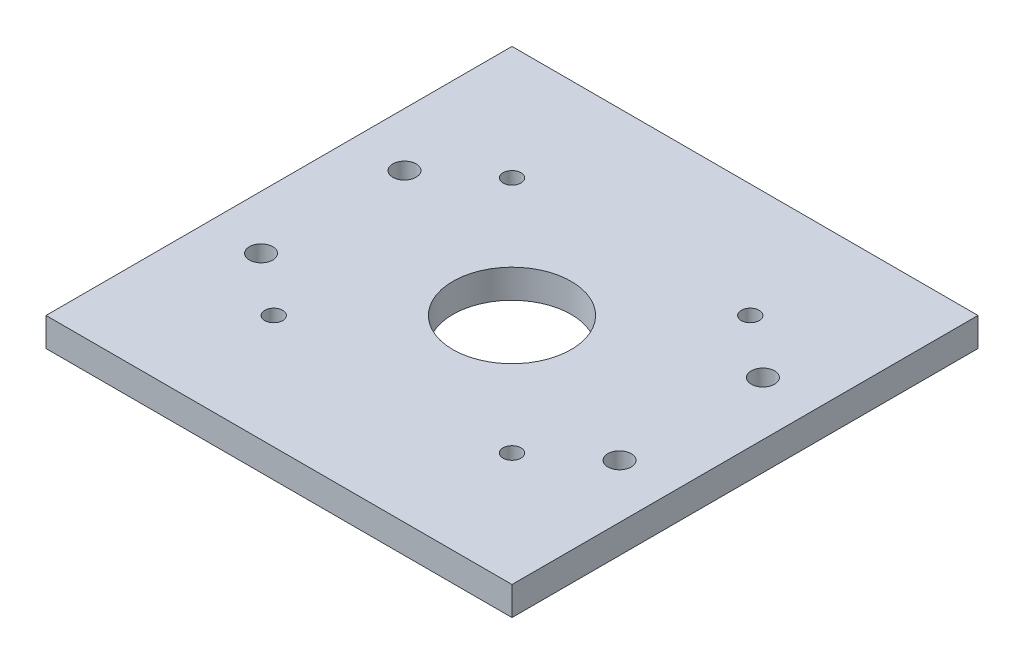
from build123d import *

# Parameters (mm, degrees)
SKETCH1_W             = 130
SKETCH1_H             = 130
SKETCH1_R             = 16.5
BOSS_EXTRUDE1_DEPTH   = 8
SKETCH2_R             = 3.25
CUT_EXTRUDE1_DEPTH    = 393.791233964
M6X1_0_TAPPED_HOLE2_D = 5


with BuildPart() as part:
    # Sketch1 → Boss-Extrude1 (new body)
    with BuildSketch(Plane(origin=(0, 0, 0), x_dir=(1, 0, 0), z_dir=(0, 1, 0))):
        with Locations((-268.470286077, -142.40906871)):
            Rectangle(SKETCH1_W, SKETCH1_H)
        with Locations(Location((-268.470286077, -142.40906871, 0), (0, 0, 270))):
            Circle(SKETCH1_R, mode=Mode.SUBTRACT)
    extrude(amount=BOSS_EXTRUDE1_DEPTH)

    # Sketch2 → Cut-Extrude1 (cut, through all)
    with BuildSketch(Plane(origin=(0, 8, 0), x_dir=(1, 0, 0), z_dir=(0, 1, 0))):
        with Locations(Location((-318.470286077, -162.40906871, 0), (0, 0, 270))):
            Circle(SKETCH2_R)
        with Locations(Location((-318.470286077, -122.40906871, 0), (0, 0, 270))):
            Circle(SKETCH2_R)
        with Locations(Location((-218.470286077, -122.40906871, 0), (0, 0, 270))):
            Circle(SKETCH2_R)
        with Locations(Location((-218.470286077, -162.40906871, 0), (0, 0, 270))):
            Circle(SKETCH2_R)
    extrude(amount=-CUT_EXTRUDE1_DEPTH, mode=Mode.SUBTRACT)

    # M6x1.0 Tapped Hole2 (through all)
    with Locations(Plane(origin=(0, 8, 0), x_dir=(1, 0, 0), z_dir=(0, 1, 0))):
        with Locations((-301.704286077, -109.17506871), (-235.236286077, -109.17506871), (-235.236286077, -175.64306871), (-301.704286077, -175.64306871)):
            Hole(M6X1_0_TAPPED_HOLE2_D / 2)


solid = part.part
